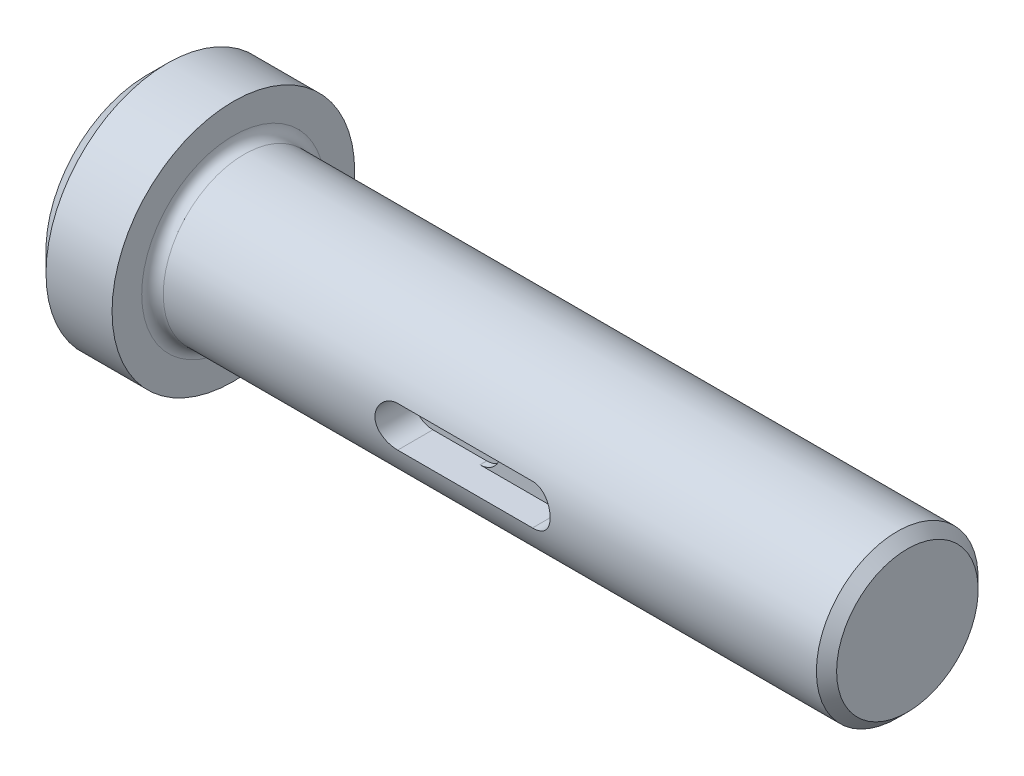
from build123d import *

# Parameters (mm, degrees)
HEADCHAMFER_SIZE   = 1.5
CUT_EXTRUDE1_DEPTH = 2.3
CUT_EXTRUDE2_DEPTH = 2.8
BODYCHAMFER_SIZE   = 0.75


with BuildPart() as part:
    # Sketch2 → Base (revolve)
    with BuildSketch(Plane.XY, mode=Mode.PRIVATE) as base_sk:
        with BuildLine():
            Line((0, 0), (0, 9))
            Line((0, 9), (6.4, 9))
            Line((6.4, 9), (6.4, 6.8))
            ThreePointArc((6.4, 6.8), (6.634314575, 6.234314575), (7.2, 6))
            Line((7.2, 6), (56.4, 6))
            Line((56.4, 6), (56.4, 0))
            Line((56.4, 0), (0, 0))
        make_face()
    revolve(base_sk.sketch.rotate(Axis((-56.067516779, 0, 0), (1, 0, 0)), 90), axis=Axis((-56.067516779, 0, 0), (1, 0, 0)))

    # HeadChamfer
    headchamfer_edges = [part.edges().sort_by_distance(p)[0] for p in [
        (0, 0, -9),
    ]]
    chamfer(headchamfer_edges, length=HEADCHAMFER_SIZE)

    # Sketch3 → Cut-Extrude1 (cut)
    with BuildSketch(Plane.XY.offset(6)):
        with BuildLine():
            Line((24.4, 1.5), (34.4, 1.5))
            ThreePointArc((34.4, 1.5), (35.9, 0), (34.4, -1.5))
            Line((34.4, -1.5), (24.4, -1.5))
            ThreePointArc((24.4, -1.5), (22.9, 0), (24.4, 1.5))
        make_face()
    extrude(amount=-CUT_EXTRUDE1_DEPTH, mode=Mode.SUBTRACT)

    # Sketch4 → Cut-Extrude2 (cut)
    with BuildSketch(Plane.XY.offset(6)):
        with BuildLine():
            Line((24.4, 1.5), (28.4, 1.5))
            ThreePointArc((28.4, 1.5), (29.9, 0), (28.4, -1.5))
            Line((28.4, -1.5), (24.4, -1.5))
            ThreePointArc((24.4, -1.5), (22.9, 0), (24.4, 1.5))
        make_face()
    extrude(amount=-CUT_EXTRUDE2_DEPTH, mode=Mode.SUBTRACT)

    # BodyChamfer
    bodychamfer_edges = [part.edges().sort_by_distance(p)[0] for p in [
        (56.4, 0, -6),
    ]]
    chamfer(bodychamfer_edges, length=BODYCHAMFER_SIZE)


solid = part.part
